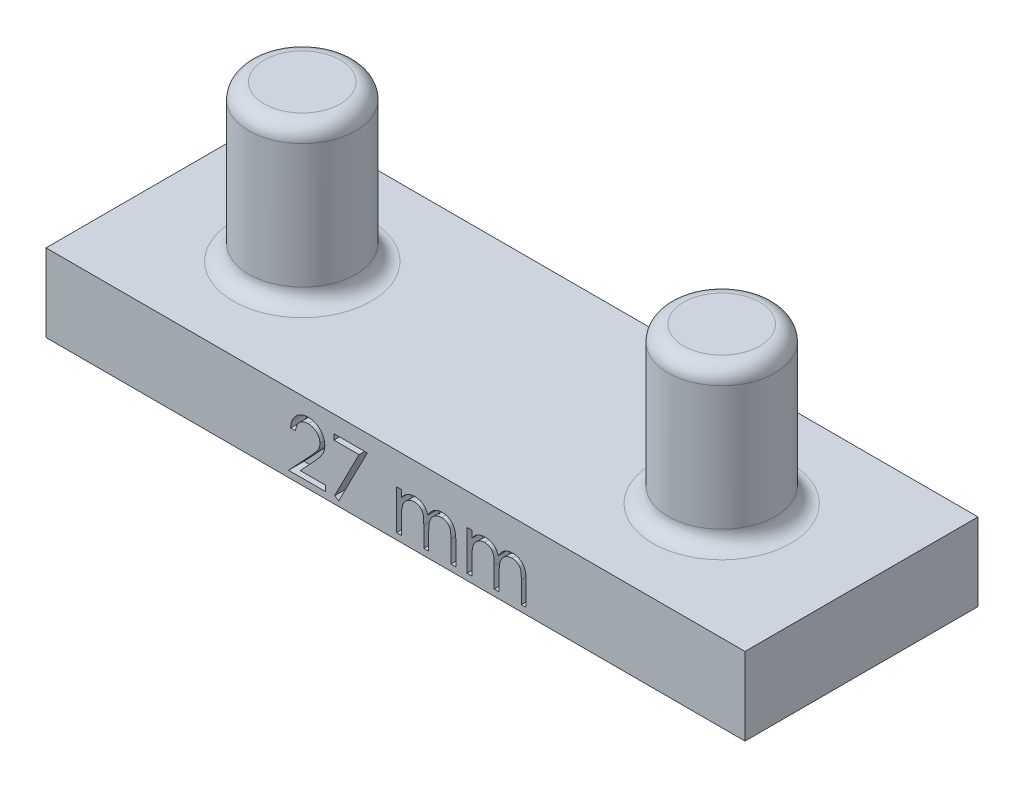
from build123d import *

# Parameters (mm, degrees)
SKETCH1_R             = 3.448679322
BOSS_EXTRUDE1_DEPTH   = 10
BOSS_EXTRUDE1_2_DEPTH = 10
SKETCH2_W             = 45
SKETCH2_H             = 15
BOSS_EXTRUDE2_DEPTH   = 5
CUT_EXTRUDE1_DEPTH    = 1
FILLET1_R             = 1


with BuildPart() as part:
    # Sketch1 → Boss-Extrude1 (new body)
    with BuildSketch(Plane(origin=(0, 0, 0), x_dir=(1, 0, 0), z_dir=(0, 1, 0))):
        with Locations(Location((-41.821276596, 3.10212766, 0), (0, 0, 270))):
            Circle(SKETCH1_R)
    extrude(amount=BOSS_EXTRUDE1_DEPTH)



with BuildPart() as body_2:
    # Sketch1 → Boss-Extrude1 2 (new body)
    with BuildSketch(Plane(origin=(0, 0, 0), x_dir=(1, 0, 0), z_dir=(0, 1, 0))):
        with Locations(Location((-14.821276596, 3.10212766, 0), (0, 0, 270))):
            Circle(SKETCH1_R)
    extrude(amount=BOSS_EXTRUDE1_2_DEPTH)


with BuildPart() as part_1:
    add(part.part)

    add(body_2.part)  # Boss-Extrude2 merges body 2
    # Sketch2 → Boss-Extrude2 (add)
    with BuildSketch(Plane.XZ):
        with Locations((-28.321276596, -3.10212766)):
            Rectangle(SKETCH2_W, SKETCH2_H)
    extrude(amount=BOSS_EXTRUDE2_DEPTH)

    # Sketch3 → Cut-Extrude1 (cut)
    with BuildSketch(Plane.XY.offset(4.39787234)):
        with BuildLine():
            Line((-23.718209968, -2.034062219), (-23.404107404, -2.034062219))
            Line((-23.404107404, -2.034062219), (-23.404107404, -2.478573436))
            add(Edge.make_bspline(
                [(-23.404107404, -2.478573436), (-23.375823454, -2.439685835), (-23.321628694, -2.365173462), (-23.232763042, -2.266983177), (-23.143986929, -2.183655023), (-23.080053547, -2.139912151), (-23.049339775, -2.118897956)],
                knots=[0, 0, 0, 0, 1.134379233, 2.173579362, 3.122582517, 4, 4, 4, 4], degree=3))
            add(Edge.make_bspline(
                [(-23.049339775, -2.118897956), (-23.007475113, -2.09889259), (-22.924477214, -2.059231377), (-22.793057989, -2.018997818), (-22.658583319, -1.994272717), (-22.567775105, -1.990891343), (-22.522096186, -1.989190424)],
                knots=[0, 0, 0, 0, 1.014936303, 2.012140481, 3.000054389, 4, 4, 4, 4], degree=3))
            add(Edge.make_bspline(
                [(-22.522096186, -1.989190424), (-22.491203189, -1.990235714), (-22.43006761, -1.992304289), (-22.33948352, -2.005764324), (-22.251624908, -2.029030497), (-22.167010879, -2.061437821), (-22.0872902, -2.100684508), (-22.014201002, -2.146734216), (-21.948576794, -2.198431291), (-21.890450742, -2.258110224), (-21.838181717, -2.327446823), (-21.79010287, -2.408311072), (-21.745677658, -2.502518733), (-21.721056349, -2.570885274), (-21.708093782, -2.606878725)],
                knots=[0, 0, 0, 0, 1.009824226, 1.998387844, 2.986035974, 3.974953746, 4.955485308, 5.885931332, 6.793869504, 7.679848016, 8.601185859, 9.625726857, 10.749998409, 12, 12, 12, 12], degree=3))
            add(Edge.make_bspline(
                [(-21.708093782, -2.606878725), (-21.69438253, -2.582154306), (-21.667400713, -2.533500121), (-21.622095076, -2.464641858), (-21.57462728, -2.400235067), (-21.524592787, -2.340228642), (-21.4721682, -2.284918912), (-21.4171068, -2.23412301), (-21.359722018, -2.187622797), (-21.279929778, -2.133299637), (-21.176117171, -2.075598456), (-21.045229056, -2.025570012), (-20.909078885, -1.994653883), (-20.816661186, -1.99102361), (-20.76999282, -1.989190424)],
                knots=[0, 0, 0, 0, 0.86119277, 1.694706429, 2.50939023, 3.298075842, 4.073795165, 4.829715201, 5.57930267, 6.321991688, 7.768977793, 9.186738141, 10.579381044, 12, 12, 12, 12], degree=3))
            add(Edge.make_bspline(
                [(-20.76999282, -1.989190424), (-20.727111357, -1.990807645), (-20.643188171, -1.993972703), (-20.521010906, -2.018826176), (-20.4070691, -2.061503823), (-20.301592024, -2.11973746), (-20.206432211, -2.192916643), (-20.123715901, -2.279985481), (-20.053945538, -2.380328104), (-20.008366898, -2.474720092), (-19.977451634, -2.558055425), (-19.9583904, -2.629061717), (-19.941550705, -2.707213269), (-19.92756946, -2.792603531), (-19.917350907, -2.885534139), (-19.909780192, -2.985853015), (-19.904656118, -3.093638127), (-19.904294046, -3.168003627), (-19.904107404, -3.20633786)],
                knots=[0, 0, 0, 0, 1.209669288, 2.367440248, 3.500751976, 4.631527125, 5.755587489, 6.87532382, 8.007944318, 9.190864318, 9.82315674, 10.514484317, 11.263564316, 12.079023757, 12.955305781, 13.901327259, 14.918167583, 16, 16, 16, 16], degree=3))
            Line((-19.904107404, -3.20633786), (-19.904107404, -4.591754526))
            Line((-19.904107404, -4.591754526), (-20.218209968, -4.591754526))
            Line((-20.218209968, -4.591754526), (-20.218209968, -3.204935616))
            add(Edge.make_bspline(
                [(-20.218209968, -3.204935616), (-20.218287851, -3.172215042), (-20.21843753, -3.109331075), (-20.221131162, -3.019078624), (-20.226206476, -2.936810267), (-20.232141114, -2.862638179), (-20.240384924, -2.79638939), (-20.251030855, -2.738196972), (-20.262308535, -2.68760316), (-20.281044526, -2.631517113), (-20.310992418, -2.569646902), (-20.356609898, -2.502923326), (-20.414080004, -2.444842526), (-20.480440161, -2.394424209), (-20.555988606, -2.353430568), (-20.639253329, -2.324154558), (-20.72971738, -2.30603168), (-20.792340169, -2.304225665), (-20.82468032, -2.303292988)],
                knots=[0, 0, 0, 0, 1.253487763, 2.409012846, 3.458416907, 4.410876679, 5.259312806, 6.014470957, 6.676830364, 7.243083969, 8.276244668, 9.299465089, 10.325150304, 11.392391894, 12.482080715, 13.603491619, 14.762376348, 16, 16, 16, 16], degree=3))
            add(Edge.make_bspline(
                [(-20.82468032, -2.303292988), (-20.864350275, -2.304709145), (-20.942753186, -2.307508011), (-21.057198672, -2.336081884), (-21.167169689, -2.379162134), (-21.269384822, -2.441594591), (-21.363412612, -2.516402955), (-21.44431219, -2.605352551), (-21.511144376, -2.705982478), (-21.556398352, -2.79912918), (-21.584987653, -2.882798624), (-21.603864569, -2.955895996), (-21.61854796, -3.038977564), (-21.632318489, -3.131485055), (-21.641306217, -3.234055235), (-21.64947459, -3.346213636), (-21.653295452, -3.468297596), (-21.653829911, -3.552924284), (-21.654107404, -3.596862699)],
                knots=[0, 0, 0, 0, 1.090531906, 2.155305635, 3.229839962, 4.33261226, 5.44038871, 6.529323825, 7.629011124, 8.757537029, 9.370236727, 10.061839251, 10.834451254, 11.692844982, 12.636905849, 13.66920014, 14.789842145, 16, 16, 16, 16], degree=3))
            Line((-21.654107404, -3.596862699), (-21.654107404, -4.591754526))
            Line((-21.654107404, -4.591754526), (-21.968209968, -4.591754526))
            Line((-21.968209968, -4.591754526), (-21.968209968, -3.291173597))
            add(Edge.make_bspline(
                [(-21.968209968, -3.291173597), (-21.968289399, -3.254480278), (-21.968442216, -3.183886021), (-21.971118533, -3.082652345), (-21.976205155, -2.990571265), (-21.982085703, -2.907749802), (-21.990545882, -2.834338473), (-22.000155644, -2.769943715), (-22.011504254, -2.714726964), (-22.030294139, -2.654163579), (-22.059008607, -2.587442656), (-22.105196869, -2.516301635), (-22.16280445, -2.454033537), (-22.230375326, -2.400874789), (-22.306381008, -2.356933307), (-22.390364409, -2.325273556), (-22.481569321, -2.306849266), (-22.544447027, -2.304500769), (-22.576783686, -2.303292988)],
                knots=[0, 0, 0, 0, 1.320475261, 2.540461679, 3.643808994, 4.639130445, 5.527981419, 6.302341397, 6.981980563, 7.553956391, 8.582137848, 9.585246428, 10.591171744, 11.620968678, 12.668337649, 13.738356861, 14.836885341, 16, 16, 16, 16], degree=3))
            add(Edge.make_bspline(
                [(-22.576783686, -2.303292988), (-22.614799897, -2.304823448), (-22.690564857, -2.3078736), (-22.801866826, -2.335327874), (-22.90935251, -2.378331949), (-23.011307209, -2.437991768), (-23.104981357, -2.511890847), (-23.186989624, -2.598805742), (-23.25593215, -2.697654776), (-23.301663965, -2.789819292), (-23.331162439, -2.871392567), (-23.350757773, -2.940743515), (-23.367597399, -3.017743763), (-23.380111421, -3.102630874), (-23.392191837, -3.194851968), (-23.398022146, -3.294866458), (-23.403693708, -3.402588546), (-23.403966123, -3.476961091), (-23.404107404, -3.515532571)],
                knots=[0, 0, 0, 0, 1.098833095, 2.189935336, 3.297829714, 4.440610912, 5.596351641, 6.740013378, 7.886572111, 9.072425424, 9.705826452, 10.395263256, 11.156850408, 11.985370555, 12.878090359, 13.847760091, 14.883794034, 16, 16, 16, 16], degree=3))
            Line((-23.404107404, -3.515532571), (-23.404107404, -4.591754526))
            Line((-23.404107404, -4.591754526), (-23.718209968, -4.591754526))
            Line((-23.718209968, -4.591754526), (-23.718209968, -2.034062219))
        make_face()
        with BuildLine():
            Line((-28.25026125, -2.034062219), (-27.936158686, -2.034062219))
            Line((-27.936158686, -2.034062219), (-27.936158686, -2.478573436))
            add(Edge.make_bspline(
                [(-27.936158686, -2.478573436), (-27.907874736, -2.439685835), (-27.853679976, -2.365173462), (-27.764814324, -2.266983177), (-27.676038211, -2.183655023), (-27.612104829, -2.139912151), (-27.581391057, -2.118897956)],
                knots=[0, 0, 0, 0, 1.134379233, 2.173579362, 3.122582517, 4, 4, 4, 4], degree=3))
            add(Edge.make_bspline(
                [(-27.581391057, -2.118897956), (-27.539526395, -2.09889259), (-27.456528496, -2.059231377), (-27.325109271, -2.018997818), (-27.190634601, -1.994272717), (-27.099826387, -1.990891343), (-27.054147468, -1.989190424)],
                knots=[0, 0, 0, 0, 1.014936303, 2.012140481, 3.000054389, 4, 4, 4, 4], degree=3))
            add(Edge.make_bspline(
                [(-27.054147468, -1.989190424), (-27.023254471, -1.990235714), (-26.962118892, -1.992304289), (-26.871534802, -2.005764324), (-26.78367619, -2.029030497), (-26.699062161, -2.061437821), (-26.619341482, -2.100684508), (-26.546252284, -2.146734216), (-26.480628076, -2.198431291), (-26.422502024, -2.258110224), (-26.370232999, -2.327446823), (-26.322154152, -2.408311072), (-26.27772894, -2.502518733), (-26.253107631, -2.570885274), (-26.240145064, -2.606878725)],
                knots=[0, 0, 0, 0, 1.009824226, 1.998387844, 2.986035974, 3.974953746, 4.955485308, 5.885931332, 6.793869504, 7.679848016, 8.601185859, 9.625726857, 10.749998409, 12, 12, 12, 12], degree=3))
            add(Edge.make_bspline(
                [(-26.240145064, -2.606878725), (-26.226433813, -2.582154306), (-26.199451995, -2.533500121), (-26.154146358, -2.464641858), (-26.106678562, -2.400235067), (-26.056644069, -2.340228642), (-26.004219482, -2.284918912), (-25.949158082, -2.23412301), (-25.8917733, -2.187622797), (-25.81198106, -2.133299637), (-25.708168453, -2.075598456), (-25.577280338, -2.025570012), (-25.441130167, -1.994653883), (-25.348712468, -1.99102361), (-25.302044102, -1.989190424)],
                knots=[0, 0, 0, 0, 0.86119277, 1.694706429, 2.50939023, 3.298075842, 4.073795165, 4.829715201, 5.57930267, 6.321991688, 7.768977793, 9.186738141, 10.579381044, 12, 12, 12, 12], degree=3))
            add(Edge.make_bspline(
                [(-25.302044102, -1.989190424), (-25.25916264, -1.990807645), (-25.175239453, -1.993972703), (-25.053062188, -2.018826176), (-24.939120382, -2.061503823), (-24.833643306, -2.11973746), (-24.738483493, -2.192916643), (-24.655767184, -2.279985481), (-24.58599682, -2.380328104), (-24.54041818, -2.474720092), (-24.509502916, -2.558055425), (-24.490441682, -2.629061717), (-24.473601987, -2.707213269), (-24.459620742, -2.792603531), (-24.449402189, -2.885534139), (-24.441831474, -2.985853015), (-24.4367074, -3.093638127), (-24.436345328, -3.168003627), (-24.436158686, -3.20633786)],
                knots=[0, 0, 0, 0, 1.209669288, 2.367440248, 3.500751976, 4.631527125, 5.755587489, 6.87532382, 8.007944318, 9.190864318, 9.82315674, 10.514484317, 11.263564316, 12.079023757, 12.955305781, 13.901327259, 14.918167583, 16, 16, 16, 16], degree=3))
            Line((-24.436158686, -3.20633786), (-24.436158686, -4.591754526))
            Line((-24.436158686, -4.591754526), (-24.75026125, -4.591754526))
            Line((-24.75026125, -4.591754526), (-24.75026125, -3.204935616))
            add(Edge.make_bspline(
                [(-24.75026125, -3.204935616), (-24.750339133, -3.172215042), (-24.750488812, -3.109331075), (-24.753182444, -3.019078624), (-24.758257758, -2.936810267), (-24.764192396, -2.862638179), (-24.772436206, -2.79638939), (-24.783082138, -2.738196972), (-24.794359817, -2.68760316), (-24.813095809, -2.631517113), (-24.8430437, -2.569646902), (-24.88866118, -2.502923326), (-24.946131286, -2.444842526), (-25.012491443, -2.394424209), (-25.088039888, -2.353430568), (-25.171304611, -2.324154558), (-25.261768662, -2.30603168), (-25.324391451, -2.304225665), (-25.356731602, -2.303292988)],
                knots=[0, 0, 0, 0, 1.253487763, 2.409012846, 3.458416907, 4.410876679, 5.259312806, 6.014470957, 6.676830364, 7.243083969, 8.276244668, 9.299465089, 10.325150304, 11.392391894, 12.482080715, 13.603491619, 14.762376348, 16, 16, 16, 16], degree=3))
            add(Edge.make_bspline(
                [(-25.356731602, -2.303292988), (-25.396401557, -2.304709145), (-25.474804468, -2.307508011), (-25.589249954, -2.336081884), (-25.699220971, -2.379162134), (-25.801436104, -2.441594591), (-25.895463894, -2.516402955), (-25.976363472, -2.605352551), (-26.043195658, -2.705982478), (-26.088449634, -2.79912918), (-26.117038935, -2.882798624), (-26.135915851, -2.955895996), (-26.150599242, -3.038977564), (-26.164369771, -3.131485055), (-26.173357499, -3.234055235), (-26.181525872, -3.346213636), (-26.185346734, -3.468297596), (-26.185881193, -3.552924284), (-26.186158686, -3.596862699)],
                knots=[0, 0, 0, 0, 1.090531906, 2.155305635, 3.229839962, 4.33261226, 5.44038871, 6.529323825, 7.629011124, 8.757537029, 9.370236727, 10.061839251, 10.834451254, 11.692844982, 12.636905849, 13.66920014, 14.789842145, 16, 16, 16, 16], degree=3))
            Line((-26.186158686, -3.596862699), (-26.186158686, -4.591754526))
            Line((-26.186158686, -4.591754526), (-26.50026125, -4.591754526))
            Line((-26.50026125, -4.591754526), (-26.50026125, -3.291173597))
            add(Edge.make_bspline(
                [(-26.50026125, -3.291173597), (-26.500340681, -3.254480278), (-26.500493498, -3.183886021), (-26.503169815, -3.082652345), (-26.508256437, -2.990571265), (-26.514136985, -2.907749802), (-26.522597164, -2.834338473), (-26.532206926, -2.769943715), (-26.543555537, -2.714726964), (-26.562345421, -2.654163579), (-26.591059889, -2.587442656), (-26.637248151, -2.516301635), (-26.694855732, -2.454033537), (-26.762426608, -2.400874789), (-26.83843229, -2.356933307), (-26.922415691, -2.325273556), (-27.013620603, -2.306849266), (-27.076498309, -2.304500769), (-27.108834968, -2.303292988)],
                knots=[0, 0, 0, 0, 1.320475261, 2.540461679, 3.643808994, 4.639130445, 5.527981419, 6.302341397, 6.981980563, 7.553956391, 8.582137848, 9.585246428, 10.591171744, 11.620968678, 12.668337649, 13.738356861, 14.836885341, 16, 16, 16, 16], degree=3))
            add(Edge.make_bspline(
                [(-27.108834968, -2.303292988), (-27.146851179, -2.304823448), (-27.222616139, -2.3078736), (-27.333918108, -2.335327874), (-27.441403792, -2.378331949), (-27.543358491, -2.437991768), (-27.637032639, -2.511890847), (-27.719040906, -2.598805742), (-27.787983432, -2.697654776), (-27.833715247, -2.789819292), (-27.863213721, -2.871392567), (-27.882809055, -2.940743515), (-27.899648681, -3.017743763), (-27.912162703, -3.102630874), (-27.924243119, -3.194851968), (-27.930073428, -3.294866458), (-27.93574499, -3.402588546), (-27.936017405, -3.476961091), (-27.936158686, -3.515532571)],
                knots=[0, 0, 0, 0, 1.098833095, 2.189935336, 3.297829714, 4.440610912, 5.596351641, 6.740013378, 7.886572111, 9.072425424, 9.705826452, 10.395263256, 11.156850408, 11.985370555, 12.878090359, 13.847760091, 14.883794034, 16, 16, 16, 16], degree=3))
            Line((-27.936158686, -3.515532571), (-27.936158686, -4.591754526))
            Line((-27.936158686, -4.591754526), (-28.25026125, -4.591754526))
            Line((-28.25026125, -4.591754526), (-28.25026125, -2.034062219))
        make_face()
        Polygon((-32.288722788, -1.091754526), (-30.134876634, -1.091754526), (-31.974620224, -4.681498116), (-32.245954359, -4.532159174), (-30.666326955, -1.450728885), (-32.288722788, -1.450728885), align=None)
        with BuildLine():
            Line((-34.756671506, -2.168677603), (-35.07077407, -2.168677603))
            add(Edge.make_bspline(
                [(-35.07077407, -2.168677603), (-35.068726917, -2.127006715), (-35.064706363, -2.045166201), (-35.045878074, -1.925842294), (-35.018937197, -1.811787496), (-34.980845743, -1.703917582), (-34.933539465, -1.601278774), (-34.876809438, -1.504278759), (-34.809615587, -1.41328757), (-34.733408853, -1.329148727), (-34.650640214, -1.251961156), (-34.561334275, -1.185305913), (-34.467489247, -1.128988242), (-34.369389848, -1.081907), (-34.265929285, -1.046567154), (-34.158046427, -1.020345514), (-34.04526729, -1.004569169), (-33.968427268, -1.002873383), (-33.929347788, -1.002010936)],
                knots=[0, 0, 0, 0, 1.10065271, 2.161652631, 3.183658789, 4.190468796, 5.17591951, 6.163126047, 7.15150782, 8.156236427, 9.156009102, 10.134482811, 11.092018607, 12.041330605, 13.001268258, 13.972401359, 14.968799086, 16, 16, 16, 16], degree=3))
            add(Edge.make_bspline(
                [(-33.929347788, -1.002010936), (-33.890969714, -1.002909393), (-33.81555817, -1.004674828), (-33.705496155, -1.019835857), (-33.600718861, -1.043581449), (-33.501431094, -1.076896865), (-33.40842503, -1.121681292), (-33.321001985, -1.175478831), (-33.238121174, -1.237698662), (-33.163514391, -1.310952476), (-33.095006311, -1.38915486), (-33.035904056, -1.472642764), (-32.985290893, -1.55887205), (-32.943103213, -1.648500251), (-32.912047074, -1.74237128), (-32.888468866, -1.839118482), (-32.875141452, -1.939743293), (-32.873096029, -2.007849849), (-32.872056122, -2.04247568)],
                knots=[0, 0, 0, 0, 1.111607364, 2.184268762, 3.212621178, 4.221274766, 5.211760367, 6.196651075, 7.1921475, 8.207485113, 9.220403448, 10.201281604, 11.166441695, 12.114753415, 13.065576456, 14.026450734, 14.996634279, 16, 16, 16, 16], degree=3))
            add(Edge.make_bspline(
                [(-32.872056122, -2.04247568), (-32.873749384, -2.091223515), (-32.877106196, -2.187863728), (-32.905820572, -2.329878591), (-32.950667083, -2.46747201), (-33.00466444, -2.578209312), (-33.059136884, -2.667442806), (-33.108224392, -2.740911511), (-33.165689203, -2.820016979), (-33.232367701, -2.904494317), (-33.306880573, -2.995005222), (-33.389902736, -3.091495017), (-33.482026218, -3.192966787), (-33.546684719, -3.262272388), (-33.580189134, -3.298184815)],
                knots=[0, 0, 0, 0, 1.184426356, 2.348067706, 3.509069118, 4.696110526, 5.333549288, 6.050745305, 6.844228056, 7.710549037, 8.667450064, 9.695053472, 10.805634456, 12, 12, 12, 12], degree=3))
            Line((-33.580189134, -3.298184815), (-34.455890256, -4.232780167))
            Line((-34.455890256, -4.232780167), (-32.827184327, -4.232780167))
            Line((-32.827184327, -4.232780167), (-32.827184327, -4.591754526))
            Line((-32.827184327, -4.591754526), (-35.205389455, -4.591754526))
            Line((-35.205389455, -4.591754526), (-33.84801766, -3.143236898))
            add(Edge.make_bspline(
                [(-33.84801766, -3.143236898), (-33.814969773, -3.108738591), (-33.751491546, -3.042474405), (-33.661708969, -2.945731445), (-33.581069981, -2.855981904), (-33.509052588, -2.773395356), (-33.447219083, -2.696763788), (-33.392346851, -2.628569084), (-33.34838126, -2.565814634), (-33.300665864, -2.49307402), (-33.254451883, -2.404261703), (-33.214739527, -2.295728014), (-33.190524678, -2.184000761), (-33.187619843, -2.108498724), (-33.186158686, -2.070520552)],
                knots=[0, 0, 0, 0, 1.329631726, 2.553950428, 3.673215718, 4.687767853, 5.603093632, 6.413772471, 7.123043292, 7.734684054, 8.834405432, 9.900288307, 10.943827018, 12, 12, 12, 12], degree=3))
            add(Edge.make_bspline(
                [(-33.186158686, -2.070520552), (-33.186794428, -2.046639153), (-33.188047354, -1.999573503), (-33.199105051, -1.930567744), (-33.215815558, -1.86400293), (-33.239760816, -1.799674311), (-33.271367556, -1.738228659), (-33.309840936, -1.679591179), (-33.354230999, -1.622902214), (-33.405582268, -1.569748916), (-33.461993788, -1.52106771), (-33.521588038, -1.477943625), (-33.584638142, -1.441904514), (-33.650878264, -1.412361017), (-33.720123734, -1.389185636), (-33.792508479, -1.373127056), (-33.867832495, -1.363044572), (-33.919265991, -1.3616804), (-33.94547359, -1.360985295)],
                knots=[0, 0, 0, 0, 0.991446411, 1.95395049, 2.89581595, 3.838931463, 4.798493298, 5.75982156, 6.748411868, 7.785213223, 8.824556874, 9.840280684, 10.836137867, 11.835679398, 12.848801643, 13.863922112, 14.911575587, 16, 16, 16, 16], degree=3))
            add(Edge.make_bspline(
                [(-33.94547359, -1.360985295), (-33.972844422, -1.361700328), (-34.026596219, -1.363104533), (-34.105515251, -1.372927197), (-34.180801029, -1.389873037), (-34.252642932, -1.413049712), (-34.321162518, -1.442508261), (-34.386026562, -1.479200005), (-34.447089451, -1.522983498), (-34.504465974, -1.572624055), (-34.557329953, -1.627891656), (-34.603776829, -1.689501619), (-34.644360843, -1.756329034), (-34.679770077, -1.828193585), (-34.708525767, -1.905747365), (-34.730498917, -1.98871507), (-34.747885764, -2.076736451), (-34.753694285, -2.137521536), (-34.756671506, -2.168677603)],
                knots=[0, 0, 0, 0, 1.031018746, 2.02475058, 2.990194455, 3.934040569, 4.864654155, 5.795059489, 6.735614925, 7.690564532, 8.649604399, 9.611025574, 10.590972636, 11.591080095, 12.624614302, 13.701020113, 14.821632451, 16, 16, 16, 16], degree=3))
        make_face()
    extrude(amount=-CUT_EXTRUDE1_DEPTH, mode=Mode.SUBTRACT)

    # Fillet1
    fillet1_edges = [part_1.edges().sort_by_distance(p)[0] for p in [
        (-14.821276596, 0, -6.550806982),
        (-14.821276596, 10, -6.550806982),
        (-41.821276596, 10, -6.550806982),
        (-41.821276596, 0, -6.550806982),
    ]]
    fillet(fillet1_edges, radius=FILLET1_R)


solid = part_1.part
